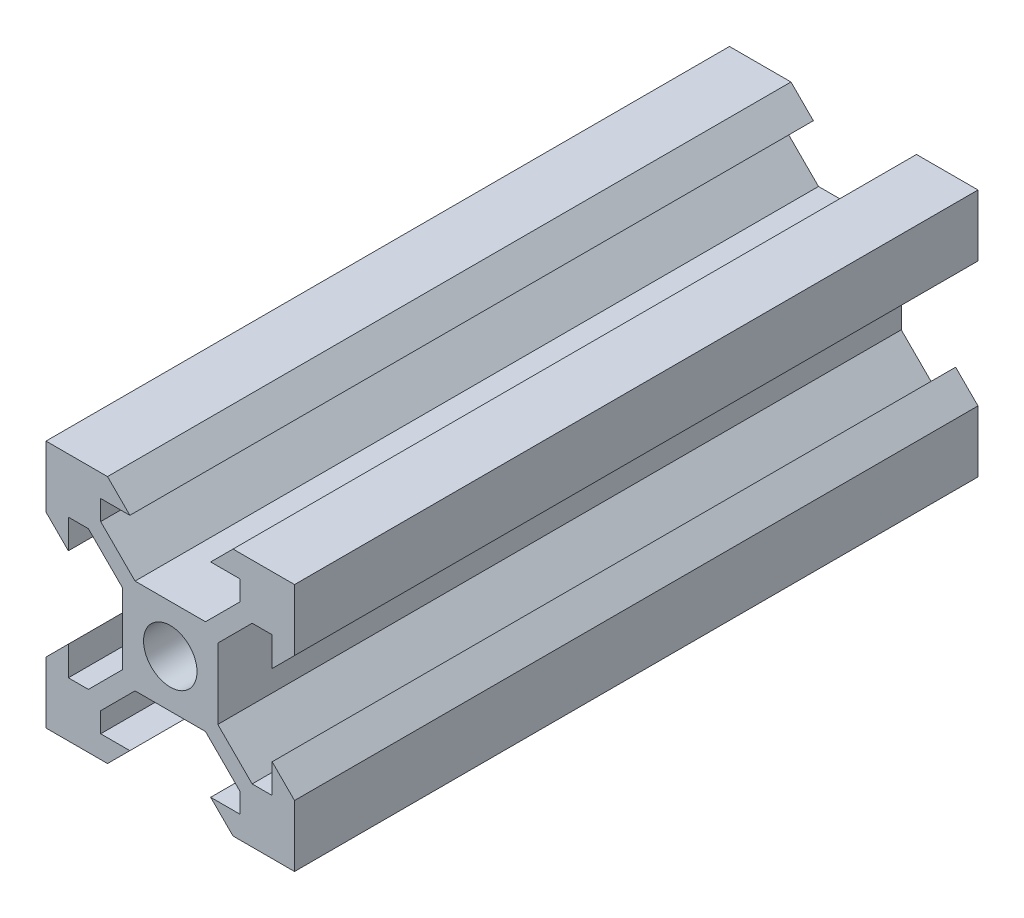
from build123d import *

# Parameters (mm, degrees)
CROQUIS1_R              = 2.15
SALIENTE_EXTRUIR2_DEPTH = 55


with BuildPart() as part:
    # Croquis1 → Saliente-Extruir2 (new body)
    with BuildSketch(Plane.XY):
        Polygon((4.4, 0), (0, 0), (0, -0.56736664), (0, -4.4), (0, -4.95), (1.8, -6.75), (1.8, -4.4), (3.410050506, -4.4), (6.175, -7.164949494), (6.175, -12.835050506), (3.410050506, -15.6), (1.8, -15.6), (1.8, -13.25), (0, -15.05), (0, -15.6), (0, -20), (4.4, -20), (4.95, -20), (6.75, -18.2), (4.4, -18.2), (4.4, -16.589949494), (7.164949494, -13.825), (12.835050506, -13.825), (15.6, -16.589949494), (15.6, -18.2), (13.25, -18.2), (15.05, -20), (15.6, -20), (18.2, -20), (20, -20), (20, -15.6), (20, -15.05), (18.2, -13.25), (18.2, -15.6), (16.589949494, -15.6), (13.825, -12.835050506), (13.825, -7.164949494), (16.589949494, -4.4), (18.2, -4.4), (18.2, -6.75), (20, -4.95), (20, -4.4), (20, 0), (15.6, 0), (15.05, 0), (13.25, -1.8), (15.6, -1.8), (15.6, -3.410050506), (12.835050506, -6.175), (7.164949494, -6.175), (4.4, -3.410050506), (4.4, -1.8), (6.75, -1.8), (4.95, 0), align=None)
        with Locations((10, -10)):
            Circle(CROQUIS1_R, mode=Mode.SUBTRACT)
    extrude(amount=SALIENTE_EXTRUIR2_DEPTH)


solid = part.part
